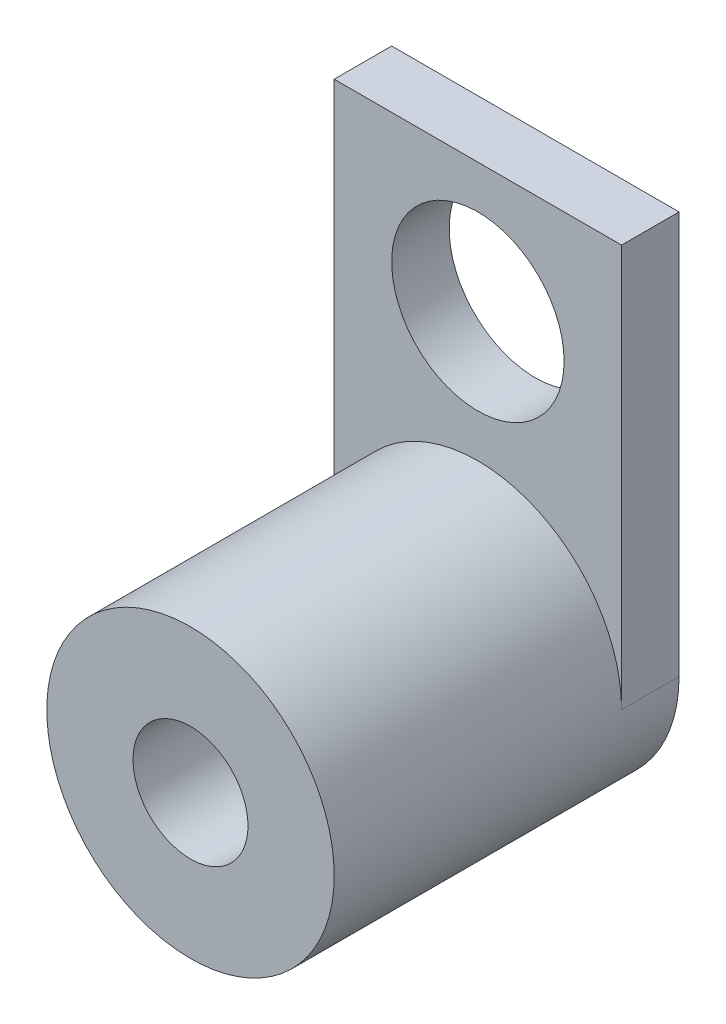
from build123d import *

# Parameters (mm, degrees)
SKETCH3_R           = 63.5
SKETCH3_R_2         = 25.4
BOSS_EXTRUDE1_DEPTH = 152.4
SKETCH4_R           = 25.4
SKETCH4_R_2         = 38.1
BOSS_EXTRUDE2_DEPTH = 25.4


with BuildPart() as part:
    # Sketch3 → Boss-Extrude1 (new body)
    with BuildSketch(Plane(origin=(0, 0, 0), x_dir=(0, 1, 0), z_dir=(0, 0, 1))):
        with Locations(Location((0, 0, 0), (0, 0, 90))):
            Circle(SKETCH3_R)
        with Locations(Location((0, 0, 0), (0, 0, 90))):
            Circle(SKETCH3_R_2, mode=Mode.SUBTRACT)
    extrude(amount=BOSS_EXTRUDE1_DEPTH)

    # Sketch4 → Boss-Extrude2 (add)
    with BuildSketch(Plane(origin=(0, 0, 0), x_dir=(0, 1, 0), z_dir=(0, 0, 1))):
        with BuildLine():
            Line((0, 63.5), (177.8, 63.5))
            Line((177.8, 63.5), (177.8, -63.5))
            Line((177.8, -63.5), (0, -63.5))
            ThreePointArc((0, -63.5), (-63.5, 0), (0, 63.5))
        make_face()
        with Locations(Location((0, 0, 0), (0, 0, 90))):
            Circle(SKETCH4_R, mode=Mode.SUBTRACT)
        with Locations(Location((120.65, 0, 0), (0, 0, 270))):
            Circle(SKETCH4_R_2, mode=Mode.SUBTRACT)
    extrude(amount=BOSS_EXTRUDE2_DEPTH)


solid = part.part
